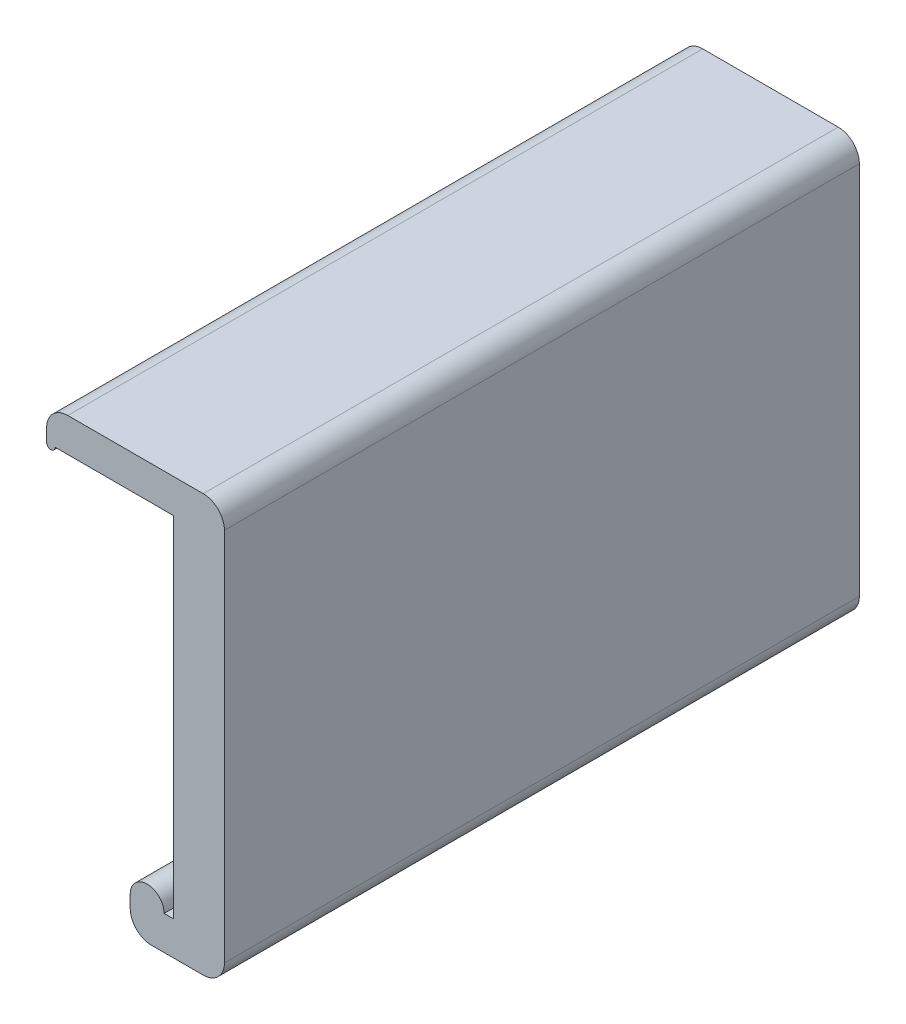
from build123d import *

# Parameters (mm, degrees)
BOSS_EXTRUDE1_DEPTH      = 7.5
BOSS_EXTRUDE1_DEPTH_BACK = 7.5
FILLET1_R                = 0.5


with BuildPart() as part:
    # Sketch2 → Boss-Extrude1 (new, two sides: drawn at the far end of the back side and taken through both)
    with BuildSketch(Plane.XY.offset(-BOSS_EXTRUDE1_DEPTH_BACK)):
        with BuildLine():
            Line((41.541321959, 7.25), (37.341321959, 7.25))
            Line((37.341321959, 7.25), (37.341321959, 6.45))
            ThreePointArc((37.341321959, 6.45), (37.441321959, 6.35), (37.541321959, 6.45))
            Line((37.541321959, 6.45), (40.341321959, 6.45))
            Line((40.341321959, 6.45), (40.341321959, -1.8))
            Line((40.341321959, -1.8), (40.116321959, -1.8))
            ThreePointArc((40.116321959, -1.8), (39.716321959, -1.4), (39.316321959, -1.8))
            Line((39.316321959, -1.8), (39.316321959, -2.6))
            Line((39.316321959, -2.6), (41.541321959, -2.6))
            Line((41.541321959, -2.6), (41.541321959, 7.25))
        make_face()
    extrude(amount=BOSS_EXTRUDE1_DEPTH + BOSS_EXTRUDE1_DEPTH_BACK)

    # Fillet1
    fillet1_edges = [part.edges().sort_by_distance(p)[0] for p in [
        (37.341321959, 7.25, 0),
        (39.316321959, -2.6, 0),
        (41.541321959, -2.6, 0),
        (41.541321959, 7.25, 0),
    ]]
    fillet(fillet1_edges, radius=FILLET1_R)


solid = part.part
